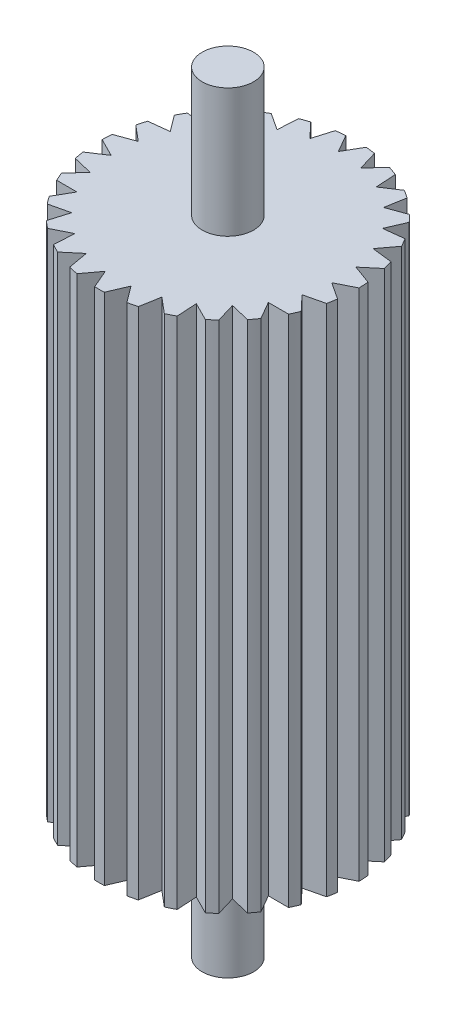
from build123d import *

# Parameters (mm, degrees)
SKETCH1_R           = 12.7
BOSS_EXTRUDE2_DEPTH = 50.8
CUT_EXTRUDE1_DEPTH  = 50.8
SKETCH3_R           = 2.54
BOSS_EXTRUDE3_DEPTH = 12.7
BOSS_EXTRUDE4_START = 12.7
SKETCH4_R           = 2.54
BOSS_EXTRUDE4_DEPTH = 12.7


with BuildPart() as part:
    # Sketch1 → Boss-Extrude2 (new body)
    with BuildSketch(Plane(origin=(0, 0, 0), x_dir=(1, 0, 0), z_dir=(0, 1, 0))):
        with Locations(Location((0, 0, 0), (0, 0, 270))):
            Circle(SKETCH1_R)
    extrude(amount=BOSS_EXTRUDE2_DEPTH)

    # Sketch2 → Cut-Extrude1 (cut)
    with BuildSketch(Plane(origin=(0, 50.8, 0), x_dir=(1, 0, 0), z_dir=(0, 1, 0))):
        Polygon((2.51878654, 10.627596076), (4.632126911, 12.867606004), (1.635551224, 13.577807488), align=None)
        Polygon((0, 10.922), (1.539793168, 13.589), (-1.539793168, 13.589), align=None)
        Polygon((4.901784646, 9.760255698), (7.474741494, 11.452516038), (4.722722626, 12.834631861), align=None)
        Polygon((7.020526273, 8.366737408), (9.914390828, 9.420017968), (7.555290828, 11.399537907), align=None)
        Polygon((8.760789511, 6.522166139), (11.819552786, 6.879684291), (9.980551347, 9.349891915), align=None)
        Polygon((10.028756319, 4.325983205), (13.087519594, 3.968465053), (11.867757759, 6.796190829), align=None)
        Polygon((10.756070278, 1.896585396), (13.649934833, 0.843304837), (13.115170278, 3.876105336), align=None)
        Polygon((10.903521705, -0.635057821), (13.476478552, -2.327318162), (13.655540573, 0.747058002), align=None)
        Polygon((10.463161454, -3.132464908), (12.576501825, -5.372474835), (13.459737141, -2.422263423), align=None)
        Polygon((9.45872946, -5.461), (10.998522628, -8.128), (12.538315796, -5.461), align=None)
        Polygon((7.944374913, -7.495131169), (8.82761023, -10.445342581), (10.940950601, -8.205332653), align=None)
        Polygon((6.001737058, -9.125197876), (6.180799079, -12.199574039), (8.753755927, -10.507313699), align=None)
        Polygon((3.735544005, -10.263322804), (3.20077945, -13.296123304), (6.094644005, -12.242842744), align=None)
        Polygon((1.267966808, -10.848149343), (0.048204973, -13.675875119), (3.106968247, -13.318356967), align=None)
        Polygon((-1.267966808, -10.848149343), (-3.106968247, -13.318356967), (-0.048204973, -13.675875119), align=None)
        Polygon((-3.735544005, -10.263322804), (-6.094644005, -12.242842744), (-3.20077945, -13.296123304), align=None)
        Polygon((-6.001737058, -9.125197876), (-8.753755927, -10.507313699), (-6.180799079, -12.199574039), align=None)
        Polygon((-7.944374913, -7.495131169), (-10.940950601, -8.205332653), (-8.82761023, -10.445342581), align=None)
        Polygon((-9.45872946, -5.461), (-12.538315796, -5.461), (-10.998522628, -8.128), align=None)
        Polygon((-10.463161454, -3.132464908), (-13.459737141, -2.422263423), (-12.576501825, -5.372474835), align=None)
        Polygon((-10.903521705, -0.635057821), (-13.655540573, 0.747058002), (-13.476478552, -2.327318162), align=None)
        Polygon((-10.756070278, 1.896585396), (-13.115170278, 3.876105336), (-13.649934833, 0.843304837), align=None)
        Polygon((-10.028756319, 4.325983205), (-11.867757759, 6.796190829), (-13.087519594, 3.968465053), align=None)
        Polygon((-8.760789511, 6.522166139), (-9.980551347, 9.349891915), (-11.819552786, 6.879684291), align=None)
        Polygon((-7.020526273, 8.366737408), (-7.555290828, 11.399537907), (-9.914390828, 9.420017968), align=None)
        Polygon((-4.901784646, 9.760255698), (-4.722722626, 12.834631861), (-7.474741494, 11.452516038), align=None)
        Polygon((-2.51878654, 10.627596076), (-1.635551224, 13.577807488), (-4.632126911, 12.867606004), align=None)
    extrude(amount=-CUT_EXTRUDE1_DEPTH, mode=Mode.SUBTRACT)

    # Sketch3 → Boss-Extrude3 (add)
    with BuildSketch(Plane(origin=(0, 0, 0), x_dir=(-1, 0, 0), z_dir=(0, -1, 0))):
        with Locations(Location((0, 0, 0), (0, 0, 270))):
            Circle(SKETCH3_R)
    extrude(amount=BOSS_EXTRUDE3_DEPTH)

    # Sketch4 → Boss-Extrude4 (add)
    with BuildSketch(Plane(origin=(0, 50.8, 0), x_dir=(1, 0, 0), z_dir=(0, 1, 0)).offset(BOSS_EXTRUDE4_START)):
        with Locations(Location((0, 0, 0), (0, 0, 270))):
            Circle(SKETCH4_R)
    extrude(amount=-BOSS_EXTRUDE4_DEPTH)


solid = part.part
